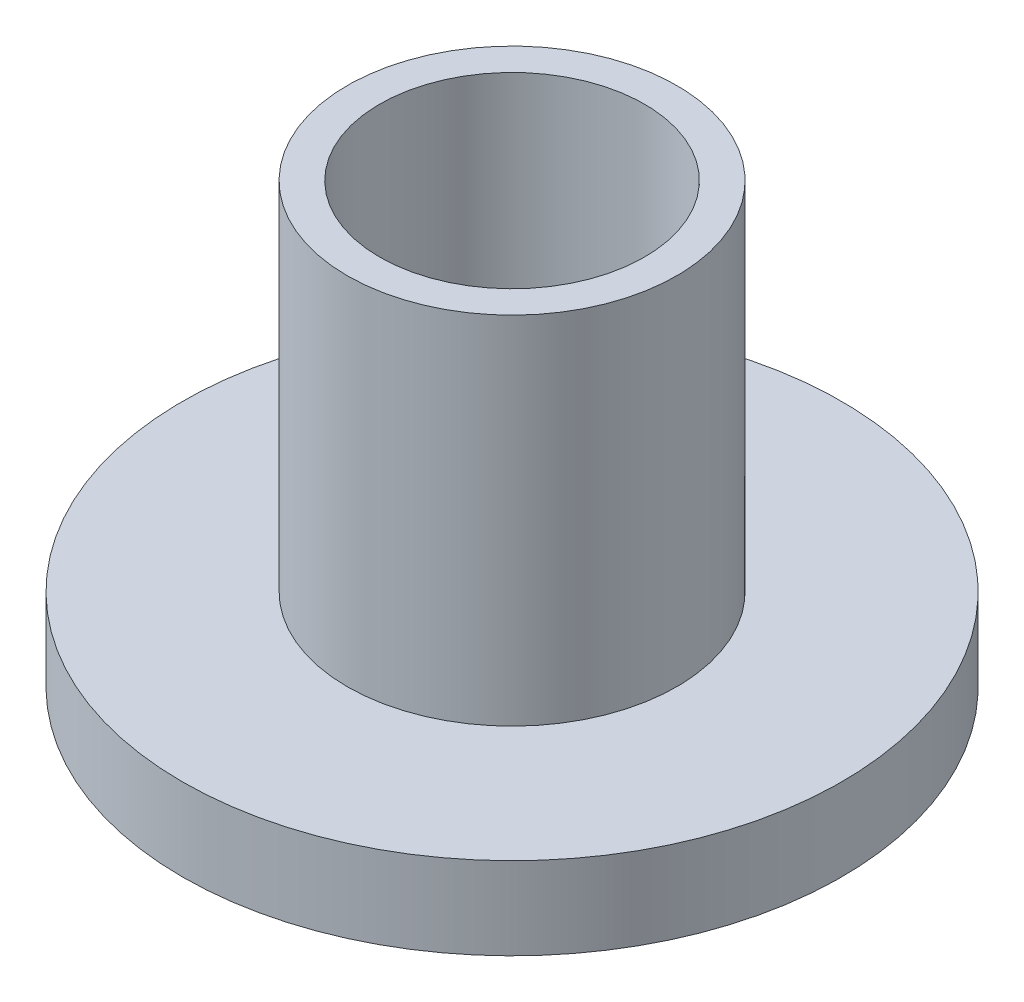
from build123d import *

# Parameters (mm, degrees)
SKETCH1_R           = 6.35
BOSS_EXTRUDE1_DEPTH = 1.5875
SKETCH2_R           = 3.175
BOSS_EXTRUDE2_DEPTH = 6.858
SKETCH3_R           = 2.5527
CUT_EXTRUDE1_DEPTH  = 13.327670917


with BuildPart() as part:
    # Sketch1 → Boss-Extrude1 (new body)
    with BuildSketch(Plane(origin=(0, 0, 0), x_dir=(1, 0, 0), z_dir=(0, 1, 0))):
        with Locations(Location((0, 0, 0), (0, 0, 270))):
            Circle(SKETCH1_R)
    extrude(amount=BOSS_EXTRUDE1_DEPTH)

    # Sketch2 → Boss-Extrude2 (add)
    with BuildSketch(Plane(origin=(0, 1.5875, 0), x_dir=(1, 0, 0), z_dir=(0, 1, 0))):
        with Locations(Location((0, 0, 0), (0, 0, 270))):
            Circle(SKETCH2_R)
    extrude(amount=BOSS_EXTRUDE2_DEPTH)

    # Sketch3 → Cut-Extrude1 (cut, through all)
    with BuildSketch(Plane(origin=(0, 8.4455, 0), x_dir=(1, 0, 0), z_dir=(0, 1, 0))):
        with Locations(Location((0, 0, 0), (0, 0, 270))):
            Circle(SKETCH3_R)
    extrude(amount=-CUT_EXTRUDE1_DEPTH, mode=Mode.SUBTRACT)


solid = part.part
